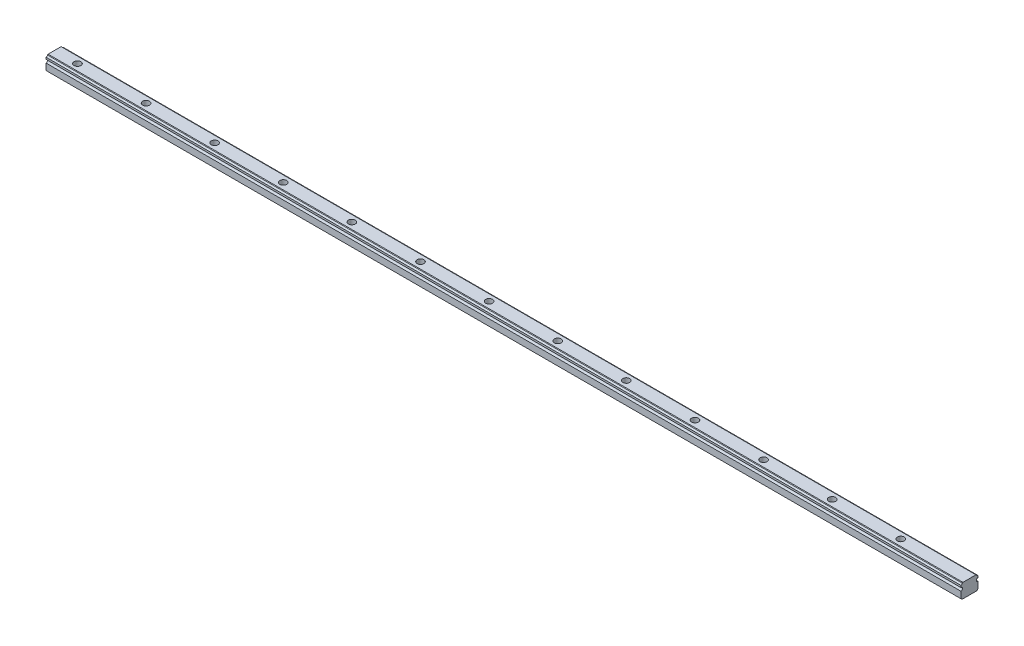
from build123d import *

# Parameters (mm, degrees)
BOSS_EXTRUDE1_DEPTH    = 800
CAP_SCREW1_D           = 3.5
CAP_SCREW1_CBORE_D     = 6
CAP_SCREW1_CBORE_DEPTH = 4.5
SCALE_1_SCALE          = 1.7


with BuildPart() as part:
    # Sketch1 → Boss-Extrude1 (new body)
    with BuildSketch(Plane(origin=(-20, 0, 0), x_dir=(0, 0, -1), z_dir=(1, 0, 0))):
        with BuildLine():
            Line((-5.692330317, 12.5), (5.692330317, 12.5))
            Line((5.692330317, 12.5), (6.192330317, 12))
            ThreePointArc((6.192330317, 12), (6.706274607, 11.346743741), (7.5, 11.1))
            Line((7.5, 11.1), (7.5, 9.5))
            ThreePointArc((7.5, 9.5), (6.1, 8.1), (7.5, 6.7))
            Line((7.5, 6.7), (7.5, 1))
            Line((7.5, 1), (6.5, 0))
            Line((6.5, 0), (-6.5, 0))
            Line((-6.5, 0), (-7.5, 1))
            Line((-7.5, 1), (-7.5, 6.7))
            ThreePointArc((-7.5, 6.7), (-6.1, 8.1), (-7.5, 9.5))
            Line((-7.5, 9.5), (-7.5, 11.1))
            ThreePointArc((-7.5, 11.1), (-6.706274607, 11.346743741), (-6.192330317, 12))
            Line((-6.192330317, 12), (-5.692330317, 12.5))
        make_face()
    extrude(amount=BOSS_EXTRUDE1_DEPTH)

    # Cap Screw1 (through all)
    with Locations(Plane(origin=(0, 12.5, 0), x_dir=(1, 0, 0), z_dir=(0, 1, 0))):
        with Locations((0, 0), (60, 0), (120, 0), (180, 0), (240, 0), (300, 0), (360, 0), (420, 0), (480, 0), (540, 0), (600, 0), (660, 0), (720, 0)):
            CounterBoreHole(CAP_SCREW1_D / 2, CAP_SCREW1_CBORE_D / 2, CAP_SCREW1_CBORE_DEPTH)


with BuildPart() as part_1:
    # 缩放比例1: scaled about (0, 0, 0)
    add(part.part.scale(SCALE_1_SCALE))


solid = part_1.part
